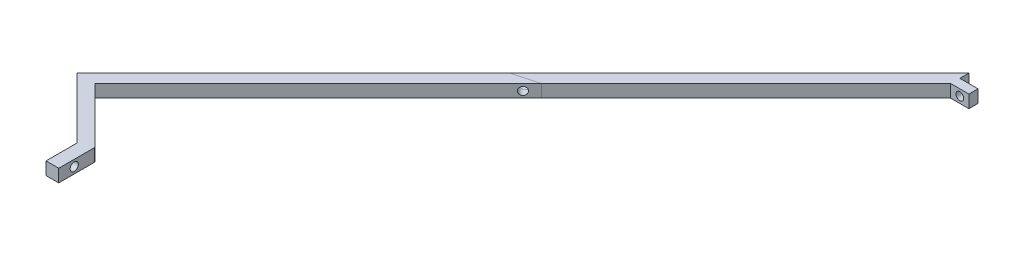
from build123d import *

# Parameters (mm, degrees)
BOSS_EXTRU_1_DEPTH           = 7
ENL_V_MAT_EXTRU_1_DEPTH      = 7
ENL_V_MAT_EXTRU_2_DEPTH      = 7
ESQUISSE8_R                  = 2.15
ENL_V_MAT_EXTRU_3_DEPTH      = 10
FRACTIONNER1_SURFACE_1_BACK  = 391.822
FRACTIONNER1_SURFACE_1_DEPTH = 783.644
FRACTIONNER1_SURFACE_2_BACK  = 391.822
FRACTIONNER1_SURFACE_2_DEPTH = 783.644


with BuildPart() as part:
    # Esquisse4 → Boss.-Extru.1 (new body)
    with BuildSketch(Plane(origin=(0, 0, 0), x_dir=(1, 0, 0), z_dir=(0, 1, 0))):
        Polygon((-21.052631579, 15.745614035), (-266.418684651, -229.620439037), (-233.113598123, -262.925525564), (-233.113598123, -280.026030628), (-226.113598123, -280.026030628), (-226.113598123, -260.347610035), (-226.43517753, -260.347610035), (-226.113598123, -260.026030628), (-256.468937182, -229.670691568), (-21.052631579, 5.745614035), (-11.052631579, 5.745614035), (-11.052631579, 10.745614035), (-21.052631579, 10.745614035), align=None)
    extrude(amount=BOSS_EXTRU_1_DEPTH)

    # Esquisse5 → Enlèv. mat.-Extru.1 (cut)
    with BuildSketch(Plane.ZY.offset(233.113598123)):
        with BuildLine():
            Line((273.725778096, 3.5), (271.475778096, 3.5))
            Line((271.475778096, 3.5), (269.225778096, 3.5))
            ThreePointArc((269.225778096, 3.5), (271.475778096, 1.25), (273.725778096, 3.5))
        make_face()
        with BuildLine():
            Line((271.475778096, 5.75), (271.475778096, 3.5))
            Line((271.475778096, 3.5), (273.725778096, 3.5))
            ThreePointArc((273.725778096, 3.5), (273.066768354, 5.090990258), (271.475778096, 5.75))
        make_face()
        with BuildLine():
            Line((269.225778096, 3.5), (271.475778096, 3.5))
            Line((271.475778096, 3.5), (271.475778096, 5.75))
            ThreePointArc((271.475778096, 5.75), (269.884787838, 5.090990258), (269.225778096, 3.5))
        make_face()
    extrude(amount=-ENL_V_MAT_EXTRU_1_DEPTH, mode=Mode.SUBTRACT)

    # Esquisse6 → Enlèv. mat.-Extru.2 (cut)
    with BuildSketch(Plane(origin=(0, 0, -10.745614035), x_dir=(-1, 0, 0), z_dir=(0, 0, -1))):
        with BuildLine():
            Line((18.202631579, 3.5), (16.052631579, 3.5))
            Line((16.052631579, 3.5), (13.902631579, 3.5))
            ThreePointArc((13.902631579, 3.5), (16.052631579, 1.35), (18.202631579, 3.5))
        make_face()
        with BuildLine():
            Line((16.052631579, 5.65), (16.052631579, 3.5))
            Line((16.052631579, 3.5), (18.202631579, 3.5))
            ThreePointArc((18.202631579, 3.5), (17.572911158, 5.02027958), (16.052631579, 5.65))
        make_face()
        with BuildLine():
            Line((13.902631579, 3.5), (16.052631579, 3.5))
            Line((16.052631579, 3.5), (16.052631579, 5.65))
            ThreePointArc((16.052631579, 5.65), (14.532351999, 5.02027958), (13.902631579, 3.5))
        make_face()
    extrude(amount=-ENL_V_MAT_EXTRU_2_DEPTH, mode=Mode.SUBTRACT)

    # Esquisse8 → Enlèv. mat.-Extru.3 (cut)
    with BuildSketch(Plane(origin=(-18.399122807, 0, -18.399122807), x_dir=(-0.7071067811865475, 0, 0.7071067811865477), z_dir=(-0.7071067811865477, 0, -0.7071067811865475))):
        with Locations((177.252628093, 3.5)):
            Circle(ESQUISSE8_R)
    extrude(amount=-ENL_V_MAT_EXTRU_3_DEPTH, mode=Mode.SUBTRACT)


with BuildPart() as body_2:
    # Fractionner1: the piece behind the surface
    add(part.part)
    # Fractionner1 surface: a surface, the sketch's curves swept straight by 783.644 mm
    with BuildLine(Plane(origin=(0, 7, 0), x_dir=(1, 0, 0), z_dir=(0, 1, 0)).offset(-FRACTIONNER1_SURFACE_1_BACK), mode=Mode.PRIVATE) as fractionner1_surface_1_path:
        Line((-147.271192021, -110.472946407), (-133.610937983, -106.812692369))
    fractionner1_surface_1 = Shell.extrude(fractionner1_surface_1_path.wire(), (0 * FRACTIONNER1_SURFACE_1_DEPTH, 1 * FRACTIONNER1_SURFACE_1_DEPTH, 0 * FRACTIONNER1_SURFACE_1_DEPTH))
    split(bisect_by=fractionner1_surface_1, keep=Keep.BOTTOM)


with BuildPart() as part_1:
    add(part.part)

    # Fractionner1: split by a surface, the side it looks to stays
    # Fractionner1 surface: a surface, the sketch's curves swept straight by 783.644 mm
    with BuildLine(Plane(origin=(0, 7, 0), x_dir=(1, 0, 0), z_dir=(0, 1, 0)).offset(-FRACTIONNER1_SURFACE_2_BACK), mode=Mode.PRIVATE) as fractionner1_surface_2_path:
        Line((-147.271192021, -110.472946407), (-133.610937983, -106.812692369))
    fractionner1_surface_2 = Shell.extrude(fractionner1_surface_2_path.wire(), (0 * FRACTIONNER1_SURFACE_2_DEPTH, 1 * FRACTIONNER1_SURFACE_2_DEPTH, 0 * FRACTIONNER1_SURFACE_2_DEPTH))
    split(bisect_by=fractionner1_surface_2, keep=Keep.TOP)


solid = Compound([body_2.part, part_1.part])
